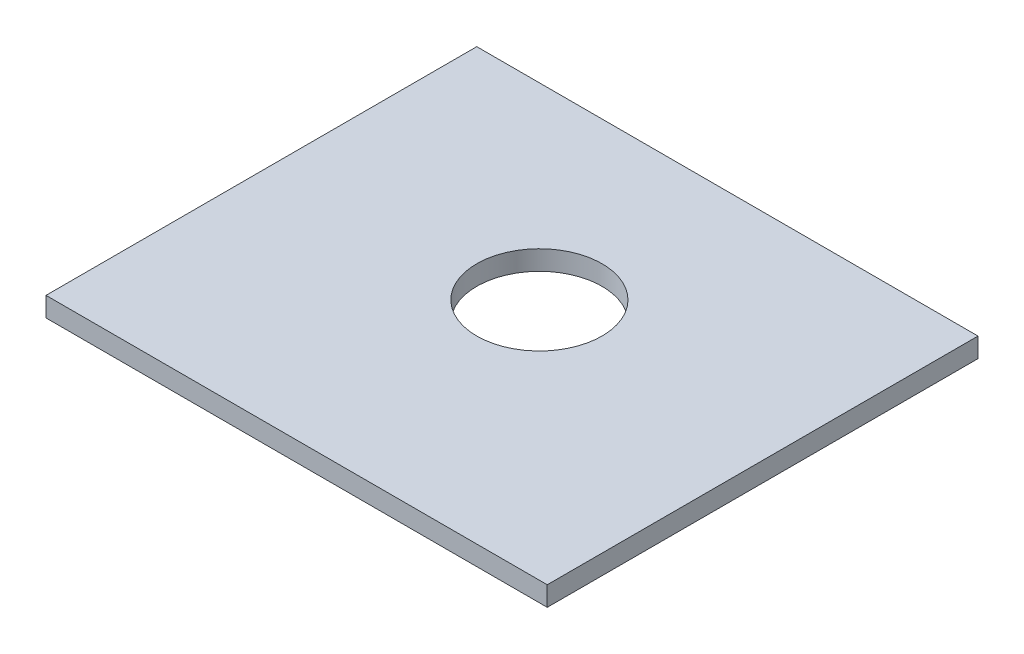
from build123d import *

# Parameters (mm, degrees)
SKETCH1_W           = 81.28
SKETCH1_H           = 69.85
BOSS_EXTRUDE1_DEPTH = 3.175
CUT_EXTRUDE1_REACH  = 55.679
SKETCH2_R           = 10.16


with BuildPart() as part:
    # Sketch1 → Boss-Extrude1 (new body)
    with BuildSketch(Plane(origin=(0, 0, 0), x_dir=(1, 0, 0), z_dir=(0, 1, 0))):
        Rectangle(SKETCH1_W, SKETCH1_H)
    extrude(amount=BOSS_EXTRUDE1_DEPTH)

    # Sketch2 → Cut-Extrude1 (cut, up to next)
    with BuildSketch(Plane(origin=(0, 3.175, 0), x_dir=(1, 0, 0), z_dir=(0, 1, 0)), mode=Mode.PRIVATE) as cut_extrude1_sk1:
        with Locations(Location((0, 4.445, 0), (0, 0, 270))):
            Circle(SKETCH2_R)
    cut_extrude1_tool1 = extrude(cut_extrude1_sk1.sketch, amount=-CUT_EXTRUDE1_REACH, mode=Mode.PRIVATE) & part.part
    add(cut_extrude1_tool1.solids().sort_by_distance((0, 3.175, -4.445))[0], mode=Mode.SUBTRACT)


solid = part.part
